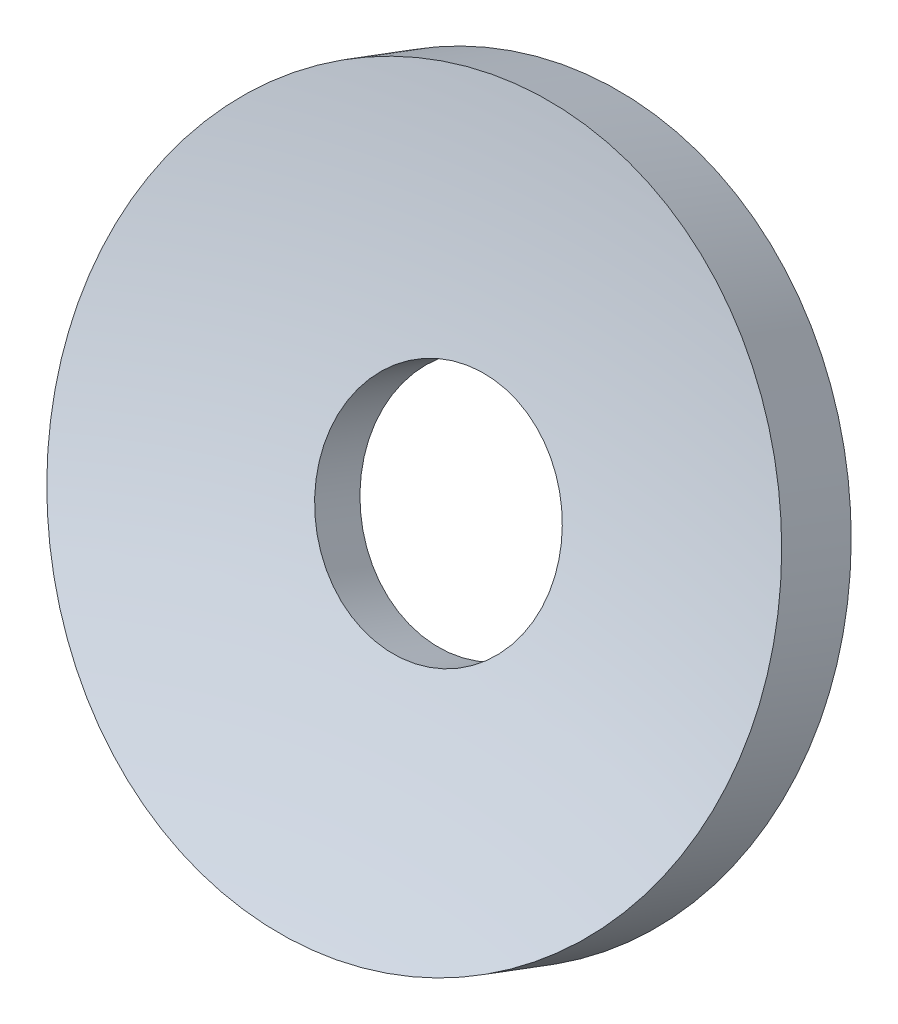
from build123d import *


with BuildPart() as part:
    # Esquisse1 → Révolution1 (revolve)
    with BuildSketch(Plane(origin=(0, -1.422218517, 0.591043356), x_dir=(1, 0, 0), z_dir=(0, -0.9234332960375348, 0.3837589709300026)), mode=Mode.PRIVATE) as r_volution1_sk:
        with BuildLine():
            Line((19.919128476, 373.637500416), (49.362338948, 371.807922022))
            Line((49.362338948, 371.807922022), (50.04455462, 382.786746266))
            ThreePointArc((50.04455462, 382.786746266), (35.236229934, 381.313857331), (20.363886252, 380.794939989))
            Line((20.363886252, 380.794939989), (19.919128476, 373.637500416))
        make_face()
    revolve(r_volution1_sk.sketch.rotate(Axis((5.897360303, 148.184557064, 360.587521222), (-0.06201960656725181, -0.3830202085297551, -0.9216556234619665)), 270), axis=Axis((5.897360303, 148.184557064, 360.587521222), (-0.06201960656725181, -0.3830202085297551, -0.9216556234619665)))


solid = part.part
